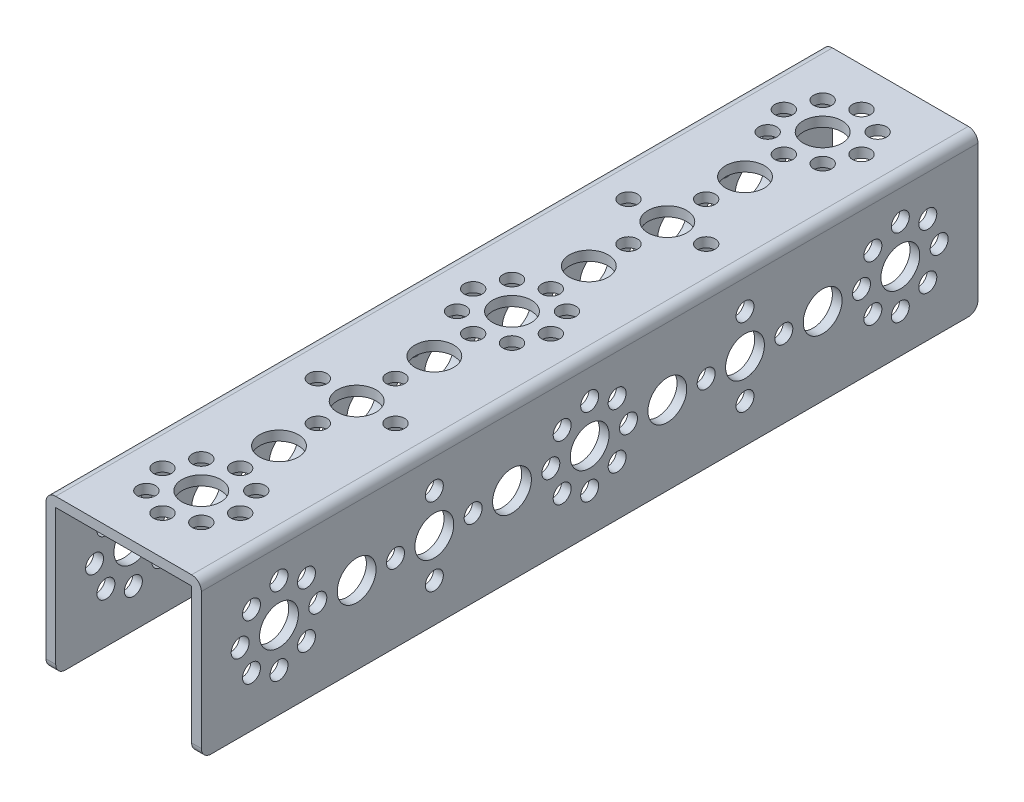
from build123d import *

# Parameters (mm, degrees)
BOSS_EXTRUDE1_DEPTH = 160
SKETCH2_R           = 4
SKETCH2_R_2         = 1.85
CUT_EXTRUDE1_DEPTH  = 164.951212255
SKETCH3_R           = 4
SKETCH3_R_2         = 1.85
CUT_EXTRUDE2_DEPTH  = 164.951212255
FILLET1_R           = 2


with BuildPart() as part:
    # Sketch1 → Boss-Extrude1 (new body)
    with BuildSketch(Plane.XY):
        Polygon((14, -16), (16, -16), (16, 16), (-16, 16), (-16, -16), (-14, -16), (-14, 14), (14, 14), align=None)
    extrude(amount=-BOSS_EXTRUDE1_DEPTH)

    # Sketch2 → Cut-Extrude1 (cut, through all)
    with BuildSketch(Plane(origin=(0, 16, 0), x_dir=(1, 0, 0), z_dir=(0, 1, 0))):
        with Locations(Location((0, 32, 0), (0, 0, 270))):
            Circle(SKETCH2_R)
        with Locations(Location((0, 64, 0), (0, 0, 270))):
            Circle(SKETCH2_R)
        with Locations(Location((-0.175415159, 96, 0), (0, 0, 270))):
            Circle(SKETCH2_R)
        with Locations(Location((0, 128, 0), (0, 0, 270))):
            Circle(SKETCH2_R)
        with Locations(Location((0, 48, 0), (0, 0, 270))):
            Circle(SKETCH2_R)
        with Locations(Location((0, 56, 0), (0, 0, 270))):
            Circle(SKETCH2_R_2)
        with Locations(Location((0, 40, 0), (0, 0, 270))):
            Circle(SKETCH2_R_2)
        with Locations(Location((8, 48, 0), (0, 0, 270))):
            Circle(SKETCH2_R_2)
        with Locations(Location((-8, 48, 0), (0, 0, 270))):
            Circle(SKETCH2_R_2)
        with Locations(Location((0, 24, 0), (0, 0, 270))):
            Circle(SKETCH2_R_2)
        with Locations(Location((8, 16, 0), (0, 0, 270))):
            Circle(SKETCH2_R_2)
        with Locations(Location((0, 16, 0), (0, 0, 270))):
            Circle(SKETCH2_R)
        with Locations(Location((-8, 16, 0), (0, 0, 270))):
            Circle(SKETCH2_R_2)
        with Locations(Location((-5.66, 10.34, 0), (0, 0, 270))):
            Circle(SKETCH2_R_2)
        with Locations(Location((5.66, 10.34, 0), (0, 0, 270))):
            Circle(SKETCH2_R_2)
        with Locations(Location((0, 8, 0), (0, 0, 270))):
            Circle(SKETCH2_R_2)
        with Locations(Location((-5.66, 21.66, 0), (0, 0, 270))):
            Circle(SKETCH2_R_2)
        with Locations(Location((5.66, 21.66, 0), (0, 0, 270))):
            Circle(SKETCH2_R_2)
        with Locations(Location((0, 112, 0), (0, 0, 270))):
            Circle(SKETCH2_R)
        with Locations(Location((0, 120, 0), (0, 0, 270))):
            Circle(SKETCH2_R_2)
        with Locations(Location((0, 104, 0), (0, 0, 270))):
            Circle(SKETCH2_R_2)
        with Locations(Location((8, 112, 0), (0, 0, 270))):
            Circle(SKETCH2_R_2)
        with Locations(Location((-8, 112, 0), (0, 0, 270))):
            Circle(SKETCH2_R_2)
        with Locations(Location((0, 88, 0), (0, 0, 270))):
            Circle(SKETCH2_R_2)
        with Locations(Location((8, 80, 0), (0, 0, 270))):
            Circle(SKETCH2_R_2)
        with Locations(Location((0, 80, 0), (0, 0, 270))):
            Circle(SKETCH2_R)
        with Locations(Location((-8, 80, 0), (0, 0, 270))):
            Circle(SKETCH2_R_2)
        with Locations(Location((-5.66, 74.34, 0), (0, 0, 270))):
            Circle(SKETCH2_R_2)
        with Locations(Location((5.66, 74.34, 0), (0, 0, 270))):
            Circle(SKETCH2_R_2)
        with Locations(Location((0, 72, 0), (0, 0, 270))):
            Circle(SKETCH2_R_2)
        with Locations(Location((-5.66, 85.66, 0), (0, 0, 270))):
            Circle(SKETCH2_R_2)
        with Locations(Location((5.66, 85.66, 0), (0, 0, 270))):
            Circle(SKETCH2_R_2)
        with Locations(Location((0, 136, 0), (0, 0, 270))):
            Circle(SKETCH2_R_2)
        with Locations(Location((-8, 144, 0), (0, 0, 270))):
            Circle(SKETCH2_R_2)
        with Locations(Location((0, 144, 0), (0, 0, 270))):
            Circle(SKETCH2_R)
        with Locations(Location((8, 144, 0), (0, 0, 270))):
            Circle(SKETCH2_R_2)
        with Locations(Location((5.66, 149.66, 0), (0, 0, 270))):
            Circle(SKETCH2_R_2)
        with Locations(Location((-5.66, 149.66, 0), (0, 0, 270))):
            Circle(SKETCH2_R_2)
        with Locations(Location((0, 152, 0), (0, 0, 270))):
            Circle(SKETCH2_R_2)
        with Locations(Location((5.66, 138.34, 0), (0, 0, 270))):
            Circle(SKETCH2_R_2)
        with Locations(Location((-5.66, 138.34, 0), (0, 0, 270))):
            Circle(SKETCH2_R_2)
    extrude(amount=-CUT_EXTRUDE1_DEPTH, mode=Mode.SUBTRACT)

    # Sketch3 → Cut-Extrude2 (cut, through all)
    with BuildSketch(Plane(origin=(16, 0, 0), x_dir=(0, 0, -1), z_dir=(1, 0, 0))):
        with Locations(Location((32, 0, 0), (0, 0, 90))):
            Circle(SKETCH3_R)
        with Locations(Location((64, 0, 0), (0, 0, 90))):
            Circle(SKETCH3_R)
        with Locations(Location((96, 0.175415159, 0), (0, 0, 90))):
            Circle(SKETCH3_R)
        with Locations(Location((128, 0, 0), (0, 0, 90))):
            Circle(SKETCH3_R)
        with Locations(Location((48, 0, 0), (0, 0, 90))):
            Circle(SKETCH3_R)
        with Locations(Location((56, 0, 0), (0, 0, 90))):
            Circle(SKETCH3_R_2)
        with Locations(Location((40, 0, 0), (0, 0, 90))):
            Circle(SKETCH3_R_2)
        with Locations(Location((48, -8, 0), (0, 0, 90))):
            Circle(SKETCH3_R_2)
        with Locations(Location((48, 8, 0), (0, 0, 90))):
            Circle(SKETCH3_R_2)
        with Locations(Location((24, 0, 0), (0, 0, 90))):
            Circle(SKETCH3_R_2)
        with Locations(Location((16, -8, 0), (0, 0, 90))):
            Circle(SKETCH3_R_2)
        with Locations(Location((16, 0, 0), (0, 0, 90))):
            Circle(SKETCH3_R)
        with Locations(Location((16, 8, 0), (0, 0, 90))):
            Circle(SKETCH3_R_2)
        with Locations(Location((10.34, 5.66, 0), (0, 0, 90))):
            Circle(SKETCH3_R_2)
        with Locations(Location((10.34, -5.66, 0), (0, 0, 90))):
            Circle(SKETCH3_R_2)
        with Locations(Location((8, 0, 0), (0, 0, 90))):
            Circle(SKETCH3_R_2)
        with Locations(Location((21.66, 5.66, 0), (0, 0, 90))):
            Circle(SKETCH3_R_2)
        with Locations(Location((21.66, -5.66, 0), (0, 0, 90))):
            Circle(SKETCH3_R_2)
        with Locations(Location((112, 0, 0), (0, 0, 90))):
            Circle(SKETCH3_R)
        with Locations(Location((120, 0, 0), (0, 0, 90))):
            Circle(SKETCH3_R_2)
        with Locations(Location((104, 0, 0), (0, 0, 90))):
            Circle(SKETCH3_R_2)
        with Locations(Location((112, -8, 0), (0, 0, 90))):
            Circle(SKETCH3_R_2)
        with Locations(Location((112, 8, 0), (0, 0, 90))):
            Circle(SKETCH3_R_2)
        with Locations(Location((88, 0, 0), (0, 0, 90))):
            Circle(SKETCH3_R_2)
        with Locations(Location((80, -8, 0), (0, 0, 90))):
            Circle(SKETCH3_R_2)
        with Locations(Location((80, 0, 0), (0, 0, 90))):
            Circle(SKETCH3_R)
        with Locations(Location((80, 8, 0), (0, 0, 90))):
            Circle(SKETCH3_R_2)
        with Locations(Location((74.34, 5.66, 0), (0, 0, 90))):
            Circle(SKETCH3_R_2)
        with Locations(Location((74.34, -5.66, 0), (0, 0, 90))):
            Circle(SKETCH3_R_2)
        with Locations(Location((72, 0, 0), (0, 0, 90))):
            Circle(SKETCH3_R_2)
        with Locations(Location((85.66, 5.66, 0), (0, 0, 90))):
            Circle(SKETCH3_R_2)
        with Locations(Location((85.66, -5.66, 0), (0, 0, 90))):
            Circle(SKETCH3_R_2)
        with Locations(Location((136, 0, 0), (0, 0, 90))):
            Circle(SKETCH3_R_2)
        with Locations(Location((144, 8, 0), (0, 0, 90))):
            Circle(SKETCH3_R_2)
        with Locations(Location((144, 0, 0), (0, 0, 90))):
            Circle(SKETCH3_R)
        with Locations(Location((144, -8, 0), (0, 0, 90))):
            Circle(SKETCH3_R_2)
        with Locations(Location((149.66, -5.66, 0), (0, 0, 90))):
            Circle(SKETCH3_R_2)
        with Locations(Location((149.66, 5.66, 0), (0, 0, 90))):
            Circle(SKETCH3_R_2)
        with Locations(Location((152, 0, 0), (0, 0, 90))):
            Circle(SKETCH3_R_2)
        with Locations(Location((138.34, -5.66, 0), (0, 0, 90))):
            Circle(SKETCH3_R_2)
        with Locations(Location((138.34, 5.66, 0), (0, 0, 90))):
            Circle(SKETCH3_R_2)
    extrude(amount=-CUT_EXTRUDE2_DEPTH, mode=Mode.SUBTRACT)

    # Fillet1
    fillet1_edges = [part.edges().sort_by_distance(p)[0] for p in [
        (-15, -16, -160),
        (-16, 16, -80),
        (16, 16, -80),
        (15, -16, -160),
        (15, -16, 0),
        (-15, -16, 0),
    ]]
    fillet(fillet1_edges, radius=FILLET1_R)


solid = part.part
